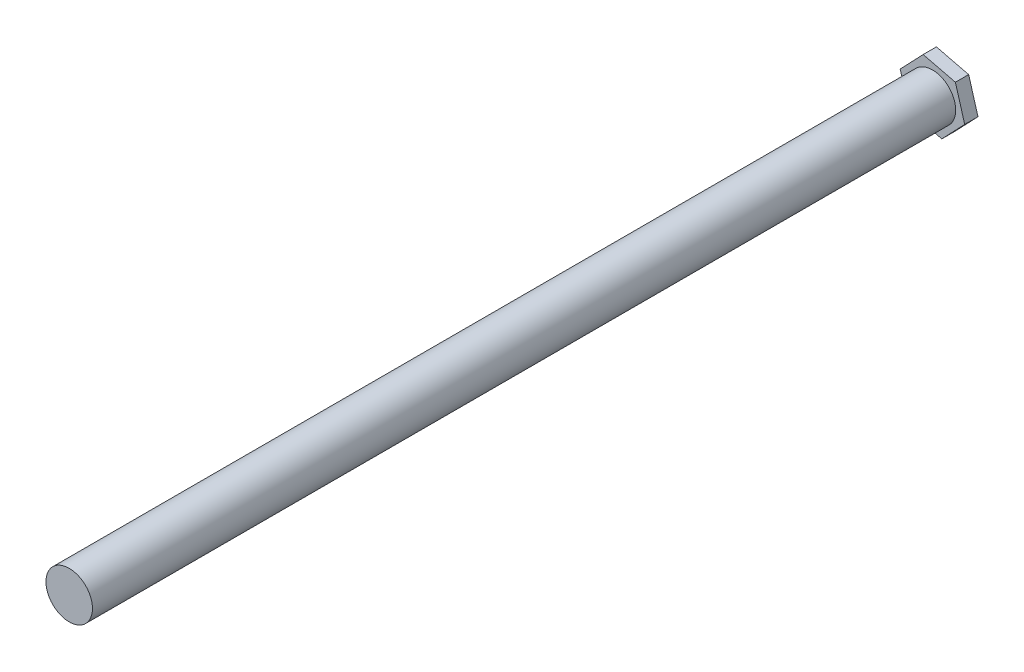
from build123d import *

# Parameters (mm, degrees)
SKETCH1_R           = 0.889
BOSS_EXTRUDE1_DEPTH = 33.02
BOSS_EXTRUDE3_DEPTH = 0.508


with BuildPart() as part:
    # Sketch1 → Boss-Extrude1 (new body)
    with BuildSketch(Plane.XY):
        Circle(SKETCH1_R)
    extrude(amount=BOSS_EXTRUDE1_DEPTH)

    # Sketch2 → Boss-Extrude3 (add)
    with BuildSketch(Plane(origin=(0, 0, 0), x_dir=(-1, 0, 0), z_dir=(0, 0, -1))):
        Polygon((0.876972004, -0.918596813), (1.234014178, 0.300181627), (0.357042174, 1.21877844), (-0.876972004, 0.918596813), (-1.234014178, -0.300181627), (-0.357042174, -1.21877844), align=None)
    extrude(amount=BOSS_EXTRUDE3_DEPTH)


solid = part.part
